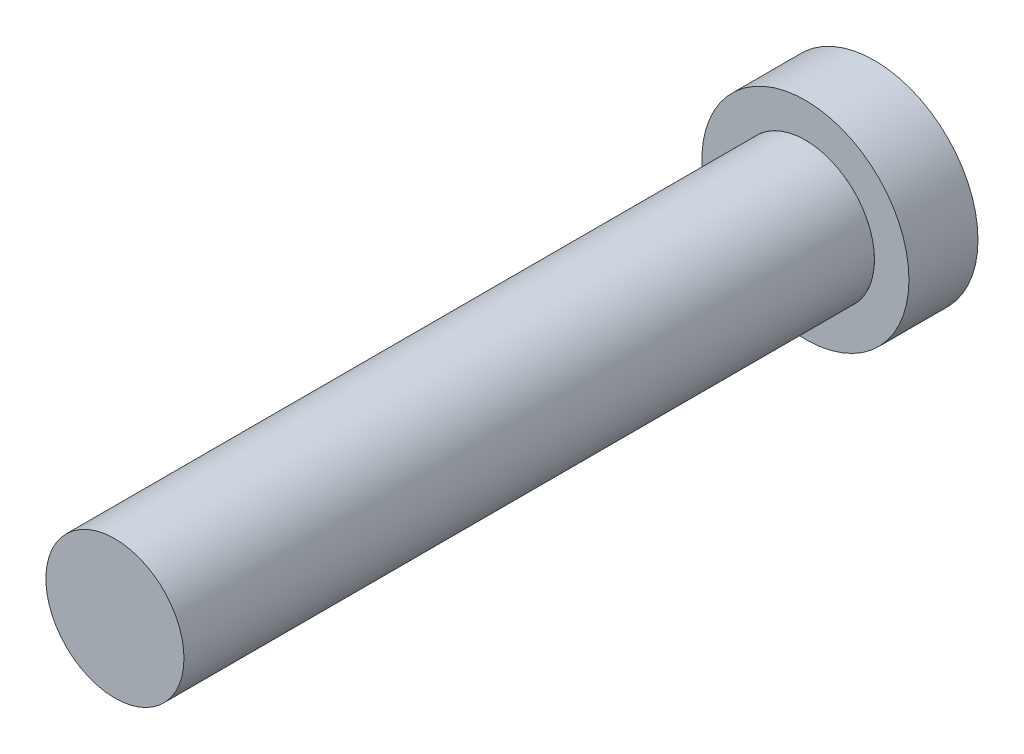
from build123d import *

# Parameters (mm, degrees)
CUT_EXTRUDE2_START = -50
SKETCH4_R          = 50
CUT_EXTRUDE2_DEPTH = 50


with BuildPart() as part:
    # Sketch2 → Revolve1 (revolve)
    with BuildSketch(Plane(origin=(0, 0, 0), x_dir=(0, 0, -1), z_dir=(1, 0, 0)), mode=Mode.PRIVATE) as revolve1_sk:
        Polygon((0, 0), (550, 0), (550, -75), (500, -75), (500, -50), (0, -50), align=None)
    revolve(revolve1_sk.sketch.rotate(Axis((0, 0, 0), (0, 0, -1)), 270), axis=Axis((0, 0, 0), (0, 0, -1)))

    # Sketch4 → Cut-Extrude2 (cut)
    with BuildSketch(Plane(origin=(0, 0, -550), x_dir=(-1, 0, 0), z_dir=(0, 0, -1)).offset(CUT_EXTRUDE2_START)):
        Circle(SKETCH4_R)
    extrude(amount=CUT_EXTRUDE2_DEPTH, mode=Mode.SUBTRACT)


with BuildPart() as cut_extrude2_piece_1:
    # of the separate pieces the step leaves, piece 1, a body of its own (cut_extrude2_pieces)
    add(part.part.solids().sort_by_distance((50, 0, 0))[0])


with BuildPart() as cut_extrude2_piece_2:
    # of the separate pieces the step leaves, piece 2, a body of its own (cut_extrude2_pieces)
    add(part.part.solids().sort_by_distance((75, 0, -550))[0])


solid = Compound([cut_extrude2_piece_1.part, cut_extrude2_piece_2.part])
